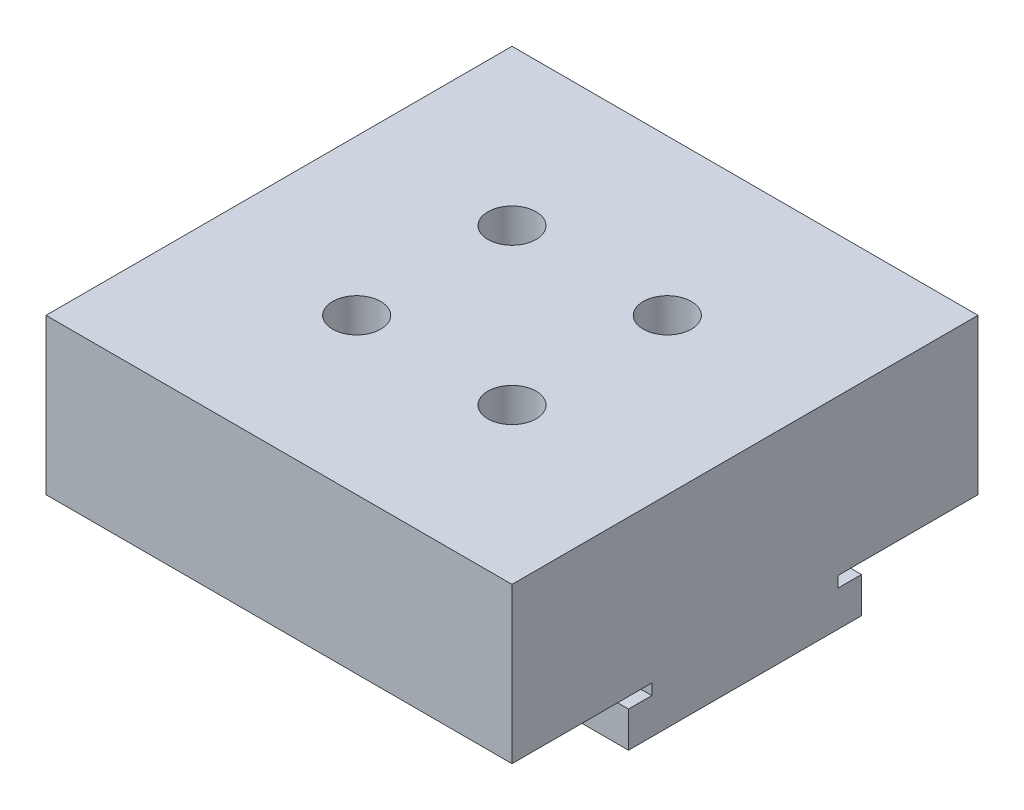
from build123d import *

# Parameters (mm, degrees)
SKETCH_1_W          = 30
SKETCH_1_H          = 30
SKETCH_1_R          = 1.55
EXTRUDE_1_DEPTH     = 10
SKETCH_2_R          = 3.5
CUT_EXTRUDE_1_DEPTH = 3
SKETCH_3_W          = 6
SKETCH_3_H          = 15
EXTRUDE_3_DEPTH     = 3
SKETCH_5_W          = 1.5
SKETCH_5_H          = 0.7
CUT_EXTRUDE_3_DEPTH = 36
SKETCH_6_R          = 3
EXTRUDE_4_DEPTH     = 6


with BuildPart() as part:
    # 草图1 → 凸台-拉伸1 (new body)
    with BuildSketch(Plane(origin=(0, 0, 0), x_dir=(1, 0, 0), z_dir=(0, 1, 0))):
        Rectangle(SKETCH_1_W, SKETCH_1_H)
        with Locations(Location((-5, 5, 0), (0, 0, 270))):
            Circle(SKETCH_1_R, mode=Mode.SUBTRACT)
        with Locations(Location((5, 5, 0), (0, 0, 270))):
            Circle(SKETCH_1_R, mode=Mode.SUBTRACT)
        with Locations(Location((5, -5, 0), (0, 0, 270))):
            Circle(SKETCH_1_R, mode=Mode.SUBTRACT)
        with Locations(Location((-5, -5, 0), (0, 0, 270))):
            Circle(SKETCH_1_R, mode=Mode.SUBTRACT)
    extrude(amount=EXTRUDE_1_DEPTH)

    # 草图2 → 切除-拉伸1 (cut)
    with BuildSketch(Plane.XZ):
        with Locations(Location((-5, 5, 0), (0, 0, 270))):
            Circle(SKETCH_2_R)
        with Locations(Location((5, 5, 0), (0, 0, 270))):
            Circle(SKETCH_2_R)
        with Locations(Location((5, -5, 0), (0, 0, 270))):
            Circle(SKETCH_2_R)
        with Locations(Location((-5, -5, 0), (0, 0, 270))):
            Circle(SKETCH_2_R)
    extrude(amount=-CUT_EXTRUDE_1_DEPTH, mode=Mode.SUBTRACT)

    # 草图3 → 凸台-拉伸3 (add)
    with BuildSketch(Plane.XZ):
        with Locations((-12, 0)):
            Rectangle(SKETCH_3_W, SKETCH_3_H)
        with Locations((12, 0)):
            Rectangle(SKETCH_3_W, SKETCH_3_H)
    extrude(amount=EXTRUDE_3_DEPTH)

    # 草图5 → 切除-拉伸3 (cut, through all)
    with BuildSketch(Plane.ZY.offset(15)):
        with Locations((-6.75, -0.35)):
            Rectangle(SKETCH_5_W, SKETCH_5_H)
        with Locations((6.75, -0.35)):
            Rectangle(SKETCH_5_W, SKETCH_5_H)
    extrude(amount=-CUT_EXTRUDE_3_DEPTH, mode=Mode.SUBTRACT)

    # 草图6 → 凸台-拉伸4 (add)
    with BuildSketch(Plane.XZ):
        with Locations(Location((0, 0, 0), (0, 0, 270))):
            Circle(SKETCH_6_R)
    extrude(amount=EXTRUDE_4_DEPTH)


solid = part.part
